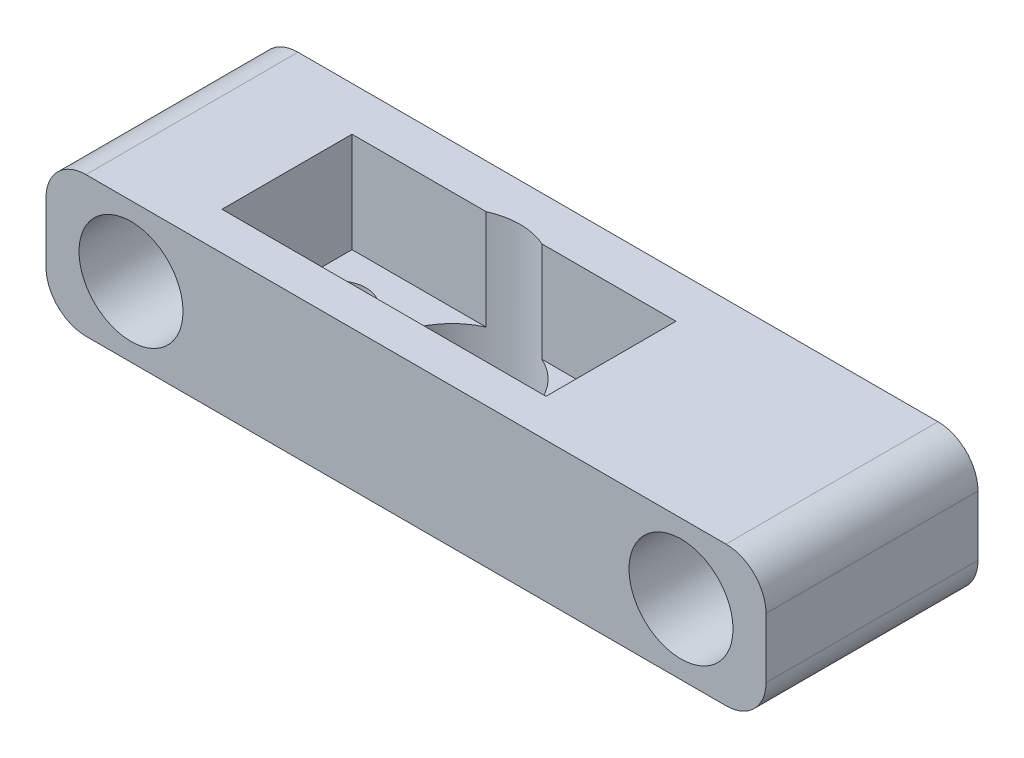
from build123d import *

# Parameters (mm, degrees)
CROQUIS1_W              = 36
CROQUIS1_H              = 7
CROQUIS1_R              = 2.6
SALIENTE_EXTRUIR1_DEPTH = 10.6
CROQUIS5_R              = 3.4
CORTAR_EXTRUIR4_DEPTH   = 7
REDONDEO1_R             = 2
CROQUIS7_W              = 16.2
CROQUIS7_H              = 6.4
CORTAR_EXTRUIR5_DEPTH   = 5
CROQUIS8_R              = 1.5
CORTAR_EXTRUIR6_DEPTH   = 2
CROQUIS9_W              = 16.2
CROQUIS9_H              = 6.2
CORTAR_EXTRUIR7_DEPTH   = 5


with BuildPart() as part:
    # Croquis1 → Saliente-Extruir1 (new body)
    with BuildSketch(Plane.XY):
        with Locations((-28.016694491, 12.37804878)):
            Rectangle(CROQUIS1_W, CROQUIS1_H)
        with Locations((-41.766694491, 12.37804878)):
            Circle(CROQUIS1_R, mode=Mode.SUBTRACT)
        with Locations((-14.266694491, 12.37804878)):
            Circle(CROQUIS1_R, mode=Mode.SUBTRACT)
    extrude(amount=SALIENTE_EXTRUIR1_DEPTH)

    # Croquis5 → Cortar-Extruir4 (cut)
    with BuildSketch(Plane.XZ.offset(-8.87804878)):
        with Locations(Location((-31.016694491, 5.3, 0), (0, 0, 270))):
            Circle(CROQUIS5_R)
    extrude(amount=-CORTAR_EXTRUIR4_DEPTH, mode=Mode.SUBTRACT)

    # Redondeo1
    redondeo1_edges = [part.edges().sort_by_distance(p)[0] for p in [
        (-46.016694491, 15.87804878, 5.3),
        (-10.016694491, 15.87804878, 5.3),
        (-10.016694491, 8.87804878, 5.3),
        (-46.016694491, 8.87804878, 5.3),
    ]]
    fillet(redondeo1_edges, radius=REDONDEO1_R)

    # Croquis7 → Cortar-Extruir5 (cut)
    with BuildSketch(Plane(origin=(0, 15.87804878, 0), x_dir=(1, 0, 0), z_dir=(0, 1, 0))):
        with Locations((-31.016694491, -5.5)):
            Rectangle(CROQUIS7_W, CROQUIS7_H)
    extrude(amount=-CORTAR_EXTRUIR5_DEPTH, mode=Mode.SUBTRACT)

    # Croquis8 → Cortar-Extruir6 (cut)
    with BuildSketch(Plane(origin=(0, 10.87804878, 0), x_dir=(1, 0, 0), z_dir=(0, 1, 0))):
        with Locations(Location((-24.916694491, -5, 0), (0, 0, 270))):
            Circle(CROQUIS8_R)
        with Locations(Location((-37.116694491, -5, 0), (0, 0, 270))):
            Circle(CROQUIS8_R)
    extrude(amount=-CORTAR_EXTRUIR6_DEPTH, mode=Mode.SUBTRACT)

    # Croquis9 → Cortar-Extruir7 (cut)
    with BuildSketch(Plane(origin=(0, 15.87804878, 0), x_dir=(1, 0, 0), z_dir=(0, 1, 0))):
        with Locations((-31.016694491, -5.3)):
            Rectangle(CROQUIS9_W, CROQUIS9_H)
    extrude(amount=-CORTAR_EXTRUIR7_DEPTH, mode=Mode.SUBTRACT)


solid = part.part
